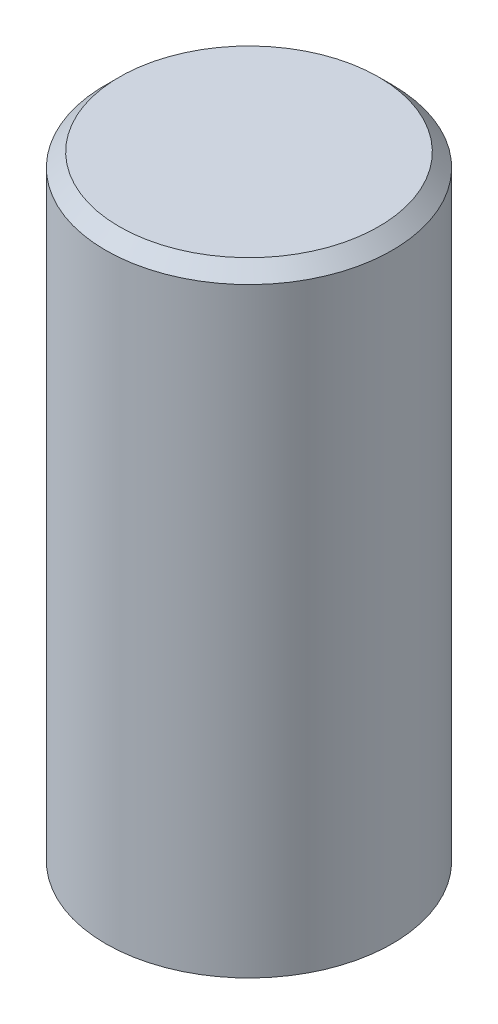
from build123d import *

# Parameters (mm, degrees)
SKETCH1_R           = 21
BOSS_EXTRUDE1_DEPTH = 90
CHAMFER1_SIZE       = 2


with BuildPart() as part:
    # Sketch1 → Boss-Extrude1 (new body)
    with BuildSketch(Plane(origin=(0, 0, 0), x_dir=(1, 0, 0), z_dir=(0, 1, 0))):
        with Locations(Location((0, 0, 0), (0, 0, 90))):
            Circle(SKETCH1_R)
    extrude(amount=BOSS_EXTRUDE1_DEPTH)

    # Chamfer1
    chamfer1_edges = [part.edges().sort_by_distance(p)[0] for p in [
        (0, 90, 21),
    ]]
    chamfer(chamfer1_edges, length=CHAMFER1_SIZE)


solid = part.part
